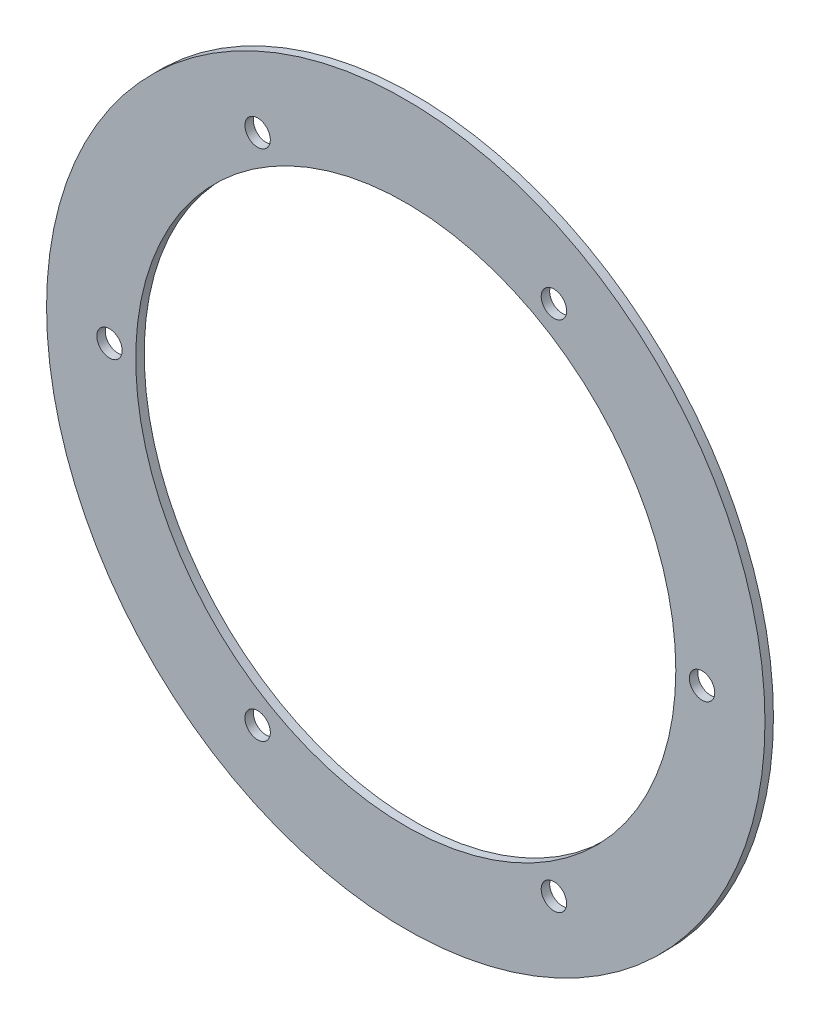
from build123d import *

# Parameters (mm, degrees)
SKIZZE1_R                       = 63.65
SKIZZE1_R_2                     = 47.85
AUFSATZ_LINEAR_AUSTRAGEN1_DEPTH = 1.5
DURCHGANGSLOCH_F_R_M41_D        = 4.5


with BuildPart() as part:
    # Skizze1 → Aufsatz-Linear austragen1 (new body)
    with BuildSketch(Plane.XY):
        Circle(SKIZZE1_R)
        Circle(SKIZZE1_R_2, mode=Mode.SUBTRACT)
    extrude(amount=AUFSATZ_LINEAR_AUSTRAGEN1_DEPTH)

    # Durchgangsloch für M41 (through all)
    with Locations(Plane.XY.offset(1.5)):
        with Locations((52.5, 0), (26.25, -45.466333699), (-26.25, -45.466333699), (-52.5, 0), (-26.25, 45.466333699), (26.25, 45.466333699)):
            Hole(DURCHGANGSLOCH_F_R_M41_D / 2)


solid = part.part
